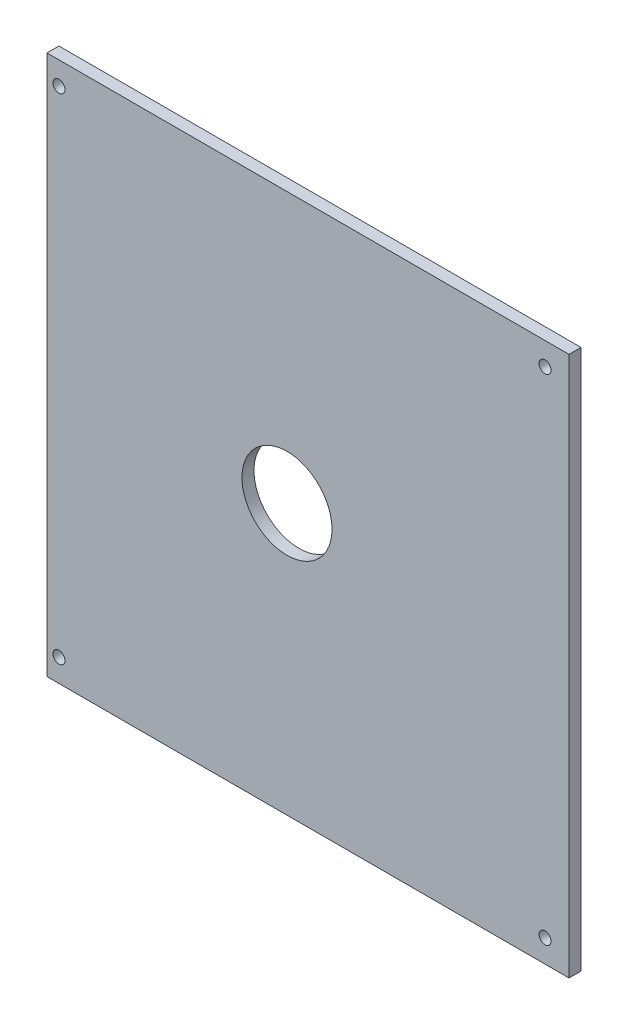
from build123d import *

# Parameters (mm, degrees)
SKETCH1_W           = 110.49
SKETCH1_H           = 114.3
BOSS_EXTRUDE1_DEPTH = 2.54
SKETCH2_R           = 9.525
CUT_EXTRUDE1_DEPTH  = 2.54
SKETCH3_R           = 1.27
CUT_EXTRUDE2_DEPTH  = 159.993653018


with BuildPart() as part:
    # Sketch1 → Boss-Extrude1 (new body)
    with BuildSketch(Plane.XY):
        with Locations((55.245, -57.15)):
            Rectangle(SKETCH1_W, SKETCH1_H)
    extrude(amount=BOSS_EXTRUDE1_DEPTH)

    # Sketch2 → Cut-Extrude1 (cut)
    with BuildSketch(Plane.XY.offset(2.54)):
        with Locations((50.8, -57.15)):
            Circle(SKETCH2_R)
    extrude(amount=-CUT_EXTRUDE1_DEPTH, mode=Mode.SUBTRACT)

    # Sketch3 → Cut-Extrude2 (cut, through all)
    with BuildSketch(Plane.XY.offset(2.54)):
        with Locations((2.54, -4.826)):
            Circle(SKETCH3_R)
        with Locations(Location((2.54, -109.474, 0), (0, 0, 180))):
            Circle(SKETCH3_R)
        with Locations((105.41, -4.826)):
            Circle(SKETCH3_R)
        with Locations((105.41, -109.474)):
            Circle(SKETCH3_R)
    extrude(amount=-CUT_EXTRUDE2_DEPTH, mode=Mode.SUBTRACT)


solid = part.part
